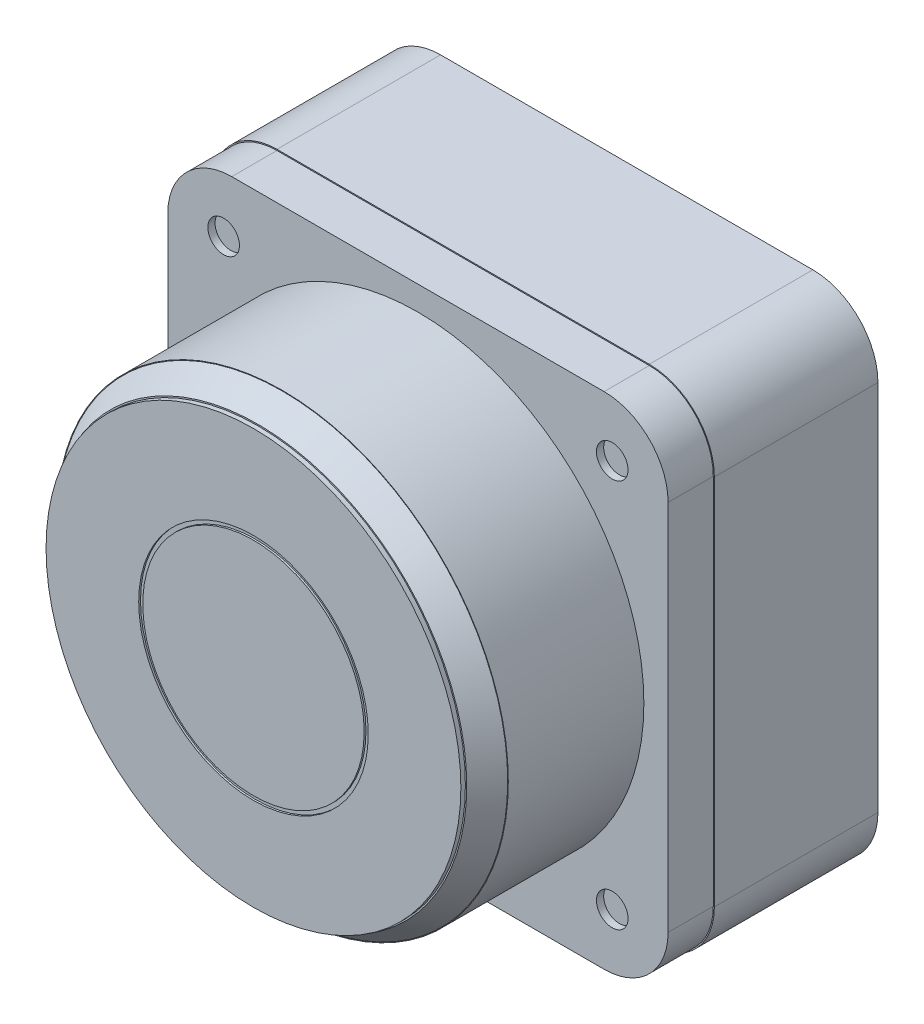
from build123d import *

# Parameters (mm, degrees)
BASE_HOUSING_DEPTH                     = 18.1
UPPER_START                            = 18
UPPER_HOUSING_RIM_DEPTH                = 5.1
OPTICAL_START                          = 23
OPTICAL_ENCLOSURE_PROFILE_R            = 25
OPTICAL_ENCLOSURE_DEPTH                = 15.1
TAPERED_START                          = 38
TAPERED_COVER_PROFILE_R                = 25
TAPERED_COVER_DEPTH                    = 2.8
TAPERED_COVER_TAPER                    = 34.159694546
COVER_START                            = 40.7
COVER_DISK_PROFILE_R                   = 22.95
COVER_DISK_DEPTH                       = 0.6
FOUR_START                             = -0.05
FOUR_M2_5_MOUNTING_POSITIONS_PROFILE_R = 1.25
FOUR_M2_5_MOUNTING_POSITIONS_DEPTH     = 4.05
UPPER_START_2                          = 22.3
UPPER_RECESSES_PROFILE_R               = 1.75
UPPER_RECESSES_DEPTH                   = 1
CABLE_START                            = -0.05
CABLE_OUTLET_RECESS_PROFILE_W          = 9
CABLE_OUTLET_RECESS_PROFILE_H          = 2.4
CABLE_OUTLET_RECESS_DEPTH              = 3.35
COVER_START_2                          = 41.1
COVER_GROOVE_PROFILE_R                 = 12.7
COVER_GROOVE_PROFILE_R_2               = 12.25
COVER_GROOVE_DEPTH                     = 0.4


with BuildPart() as part:
    # Base housing profile → Base housing (new body)
    with BuildSketch(Plane.XY):
        with BuildLine():
            Line((-20.6, -27.8), (20.6, -27.8))
            ThreePointArc((20.6, -27.8), (25.691168825, -25.691168825), (27.8, -20.6))
            Line((27.8, -20.6), (27.8, 20.6))
            ThreePointArc((27.8, 20.6), (25.691168825, 25.691168825), (20.6, 27.8))
            Line((20.6, 27.8), (-20.6, 27.8))
            ThreePointArc((-20.6, 27.8), (-25.691168825, 25.691168825), (-27.8, 20.6))
            Line((-27.8, 20.6), (-27.8, -20.6))
            ThreePointArc((-27.8, -20.6), (-25.691168825, -25.691168825), (-20.6, -27.8))
        make_face()
    extrude(amount=BASE_HOUSING_DEPTH)

    # Upper housing rim profile → Upper housing rim (add)
    with BuildSketch(Plane.XY.offset(UPPER_START)):
        with BuildLine():
            Line((-20.6, -27.68), (20.6, -27.68))
            ThreePointArc((20.6, -27.68), (25.606316011, -25.606316011), (27.68, -20.6))
            Line((27.68, -20.6), (27.68, 20.6))
            ThreePointArc((27.68, 20.6), (25.606316011, 25.606316011), (20.6, 27.68))
            Line((20.6, 27.68), (-20.6, 27.68))
            ThreePointArc((-20.6, 27.68), (-25.606316011, 25.606316011), (-27.68, 20.6))
            Line((-27.68, 20.6), (-27.68, -20.6))
            ThreePointArc((-27.68, -20.6), (-25.606316011, -25.606316011), (-20.6, -27.68))
        make_face()
    extrude(amount=UPPER_HOUSING_RIM_DEPTH)

    # Optical enclosure profile → Optical enclosure (add)
    with BuildSketch(Plane.XY.offset(OPTICAL_START)):
        Circle(OPTICAL_ENCLOSURE_PROFILE_R)
    extrude(amount=OPTICAL_ENCLOSURE_DEPTH)

    # Tapered cover profile → Tapered cover (add)
    with BuildSketch(Plane.XY.offset(TAPERED_START)):
        Circle(TAPERED_COVER_PROFILE_R)
    extrude(amount=TAPERED_COVER_DEPTH, taper=TAPERED_COVER_TAPER)

    # Cover disk profile → Cover disk (add)
    with BuildSketch(Plane.XY.offset(COVER_START)):
        Circle(COVER_DISK_PROFILE_R)
    extrude(amount=COVER_DISK_DEPTH)

    # Four M2.5 mounting positions profile → Four M2.5 mounting positions (cut)
    with BuildSketch(Plane.XY.offset(FOUR_START)):
        with Locations((-21.5, -21.5)):
            Circle(FOUR_M2_5_MOUNTING_POSITIONS_PROFILE_R)
        with Locations((-21.5, 21.5)):
            Circle(FOUR_M2_5_MOUNTING_POSITIONS_PROFILE_R)
        with Locations((21.5, -21.5)):
            Circle(FOUR_M2_5_MOUNTING_POSITIONS_PROFILE_R)
        with Locations((21.5, 21.5)):
            Circle(FOUR_M2_5_MOUNTING_POSITIONS_PROFILE_R)
    extrude(amount=FOUR_M2_5_MOUNTING_POSITIONS_DEPTH, mode=Mode.SUBTRACT)

    # Upper recesses profile → Upper recesses (cut)
    with BuildSketch(Plane.XY.offset(UPPER_START_2)):
        with Locations((-21.5, -21.5)):
            Circle(UPPER_RECESSES_PROFILE_R)
        with Locations((-21.5, 21.5)):
            Circle(UPPER_RECESSES_PROFILE_R)
        with Locations((21.5, -21.5)):
            Circle(UPPER_RECESSES_PROFILE_R)
        with Locations((21.5, 21.5)):
            Circle(UPPER_RECESSES_PROFILE_R)
    extrude(amount=UPPER_RECESSES_DEPTH, mode=Mode.SUBTRACT)

    # Cable outlet recess profile → Cable outlet recess (cut)
    with BuildSketch(Plane.XY.offset(CABLE_START)):
        with Locations((0, -26.8)):
            Rectangle(CABLE_OUTLET_RECESS_PROFILE_W, CABLE_OUTLET_RECESS_PROFILE_H)
    extrude(amount=CABLE_OUTLET_RECESS_DEPTH, mode=Mode.SUBTRACT)

    # Cover groove profile → Cover groove (cut)
    with BuildSketch(Plane.XY.offset(COVER_START_2)):
        Circle(COVER_GROOVE_PROFILE_R)
        Circle(COVER_GROOVE_PROFILE_R_2, mode=Mode.SUBTRACT)
    extrude(amount=COVER_GROOVE_DEPTH, mode=Mode.SUBTRACT)


solid = part.part
